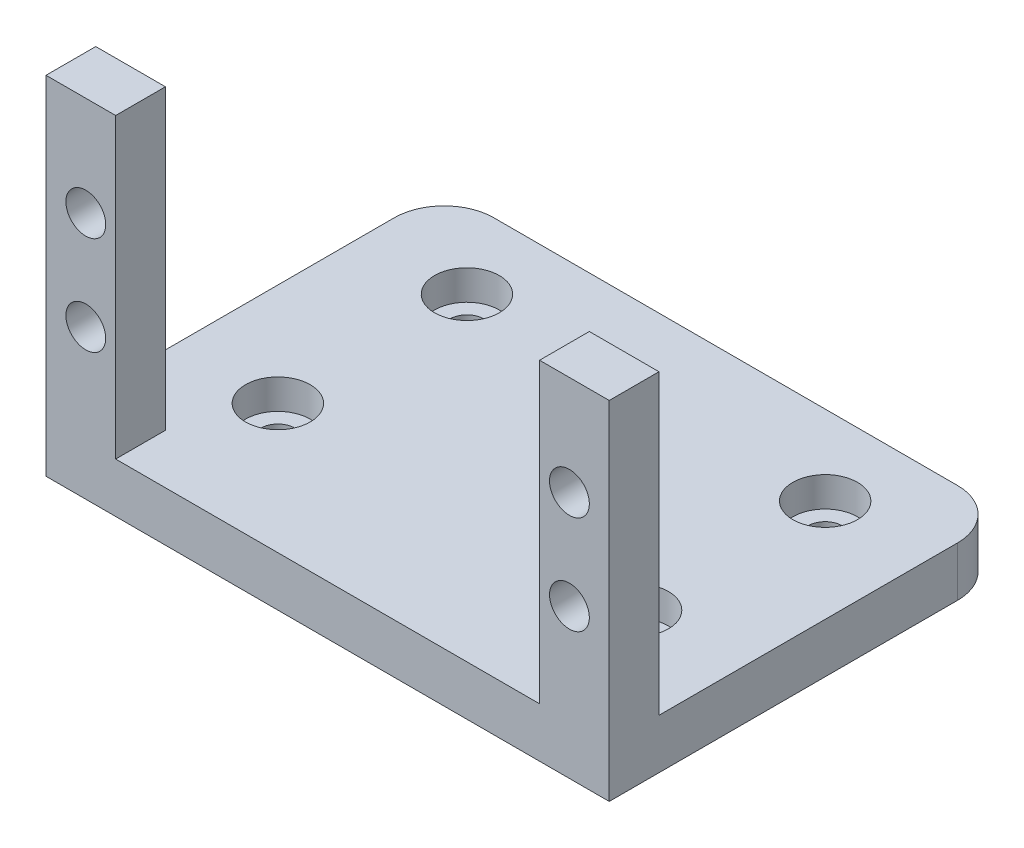
from build123d import *

# Parameters (mm, degrees)
SKETCH3_W                      = 56.6
SKETCH3_H                      = 40
BOSS_EXTRUDE1_DEPTH            = 5
SKETCH2_W                      = 7
SKETCH2_H                      = 29.9
SKETCH2_R                      = 2
BOSS_EXTRUDE2_DEPTH            = 5
CBORE_FOR_M3_SHCS2_D           = 3.4
CBORE_FOR_M3_SHCS2_DEPTH       = 5
CBORE_FOR_M3_SHCS2_CBORE_D     = 6.5
CBORE_FOR_M3_SHCS2_CBORE_DEPTH = 3
CBORE_FOR_M3_SHCS2_TIP         = 1.021463052
FILLET1_R                      = 5


with BuildPart() as part:
    # Sketch3 → Boss-Extrude1 (new body)
    with BuildSketch(Plane(origin=(0, 0, 0), x_dir=(1, 0, 0), z_dir=(0, 1, 0))):
        with Locations((0, 20)):
            Rectangle(SKETCH3_W, SKETCH3_H)
    extrude(amount=-BOSS_EXTRUDE1_DEPTH)

    # Sketch2 → Boss-Extrude2 (add)
    # profile 1 of 2: a face of its own
    with BuildSketch(Plane.XY):
        with Locations((-24.8, 14.95)):
            Rectangle(SKETCH2_W, SKETCH2_H)
        with Locations((-24.3, 19.9)):
            Circle(SKETCH2_R, mode=Mode.SUBTRACT)
        with Locations((-24.3, 10)):
            Circle(SKETCH2_R, mode=Mode.SUBTRACT)
    # profile 2 of 2: a face of its own
    with BuildSketch(Plane.XY):
        with Locations((24.8, 14.95)):
            Rectangle(SKETCH2_W, SKETCH2_H)
        with Locations(Location((24.3, 10, 0), (0, 0, 180))):
            Circle(SKETCH2_R, mode=Mode.SUBTRACT)
        with Locations(Location((24.3, 19.9, 0), (0, 0, 180))):
            Circle(SKETCH2_R, mode=Mode.SUBTRACT)
    extrude(amount=-BOSS_EXTRUDE2_DEPTH)

    # CBORE for M3 SHCS2
    with Locations(Plane(origin=(0, 0, 0), x_dir=(1, 0, 0), z_dir=(0, 1, 0))):
        with Locations((-18, 32), (18, 13), (-18, 13), (18, 32)):
            CounterBoreHole(CBORE_FOR_M3_SHCS2_D / 2, CBORE_FOR_M3_SHCS2_CBORE_D / 2, CBORE_FOR_M3_SHCS2_CBORE_DEPTH, depth=CBORE_FOR_M3_SHCS2_DEPTH)
            with Locations((0, 0, -(CBORE_FOR_M3_SHCS2_DEPTH + CBORE_FOR_M3_SHCS2_TIP / 2))):  # 118° drill point
                Cone(0, CBORE_FOR_M3_SHCS2_D / 2, CBORE_FOR_M3_SHCS2_TIP, mode=Mode.SUBTRACT)

    # Fillet1
    fillet1_edges = [part.edges().sort_by_distance(p)[0] for p in [
        (-28.3, -2.5, -40),
        (28.3, -2.5, -40),
    ]]
    fillet(fillet1_edges, radius=FILLET1_R)


solid = part.part
